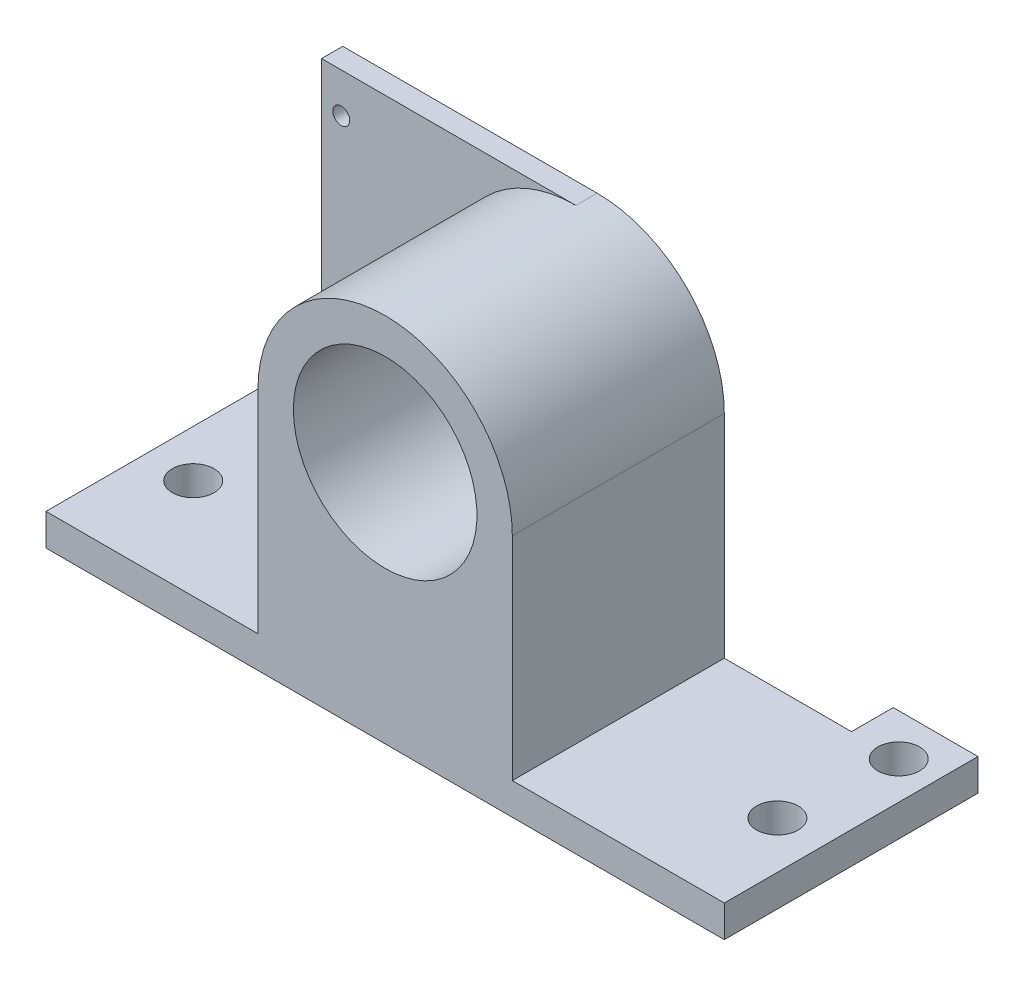
from build123d import *

# Parameters (mm, degrees)
SKETCH1_R               = 11
BOSS_EXTRUDE1_DEPTH     = 30.4
CUT_EXTRUDE1_DEPTH      = 65.4
CUT_EXTRUDE1_DEPTH_BACK = 30.4
SKETCH2_R               = 2.5
SKETCH2_W               = 60.96
SKETCH2_H               = 5
SKETCH3_R               = 1.016
BOSS_EXTRUDE2_DEPTH     = 2.54


with BuildPart() as part:
    # Sketch1 → Boss-Extrude1 (new body)
    with BuildSketch(Plane.XY):
        with BuildLine():
            Line((-40.64, -29.21), (40.64, -29.21))
            Line((40.64, -29.21), (40.64, -25.4))
            Line((40.64, -25.4), (15.24, -25.4))
            Line((15.24, -25.4), (15.24, 0))
            ThreePointArc((15.24, 0), (0, 15.24), (-15.24, 0))
            Line((-15.24, 0), (-15.24, -25.4))
            Line((-15.24, -25.4), (-40.64, -25.4))
            Line((-40.64, -25.4), (-40.64, -29.21))
        make_face()
        with Locations(Location((0, 0, 0), (0, 0, 180))):
            Circle(SKETCH1_R, mode=Mode.SUBTRACT)
    extrude(amount=BOSS_EXTRUDE1_DEPTH)

    # Sketch2 → Cut-Extrude1 (cut, two sides: drawn at the far end of the back side and taken through both)
    with BuildSketch(Plane(origin=(0, -25.4, 0), x_dir=(1, 0, 0), z_dir=(0, 1, 0)).offset(-CUT_EXTRUDE1_DEPTH_BACK)):
        with Locations(Location((-36.14, -5, 0), (0, 0, 90))):
            Circle(SKETCH2_R)
        with Locations(Location((-35, -18.4, 0), (0, 0, 90))):
            Circle(SKETCH2_R)
        with Locations(Location((36.14, -5, 0), (0, 0, 90))):
            Circle(SKETCH2_R)
        with Locations(Location((35, -18.4, 0), (0, 0, 90))):
            Circle(SKETCH2_R)
        with Locations((0, -2.5)):
            Rectangle(SKETCH2_W, SKETCH2_H)
    extrude(amount=CUT_EXTRUDE1_DEPTH + CUT_EXTRUDE1_DEPTH_BACK, mode=Mode.SUBTRACT)

    # Sketch3 → Boss-Extrude2 (add)
    with BuildSketch(Plane(origin=(0, 0, 5), x_dir=(-1, 0, 0), z_dir=(0, 0, -1))):
        with BuildLine():
            Line((0, 11), (0, 15.24))
            Line((0, 15.24), (30.48, 15.24))
            Line((30.48, 15.24), (30.48, -25.4))
            Line((30.48, -25.4), (0, -25.4))
            Line((0, -25.4), (0, -11))
            ThreePointArc((0, -11), (11, 0), (0, 11))
        make_face()
        with Locations((28.1178, 10.4775)):
            Circle(SKETCH3_R, mode=Mode.SUBTRACT)
        with Locations((28.1178, -10.4775)):
            Circle(SKETCH3_R, mode=Mode.SUBTRACT)
    extrude(amount=-BOSS_EXTRUDE2_DEPTH)


solid = part.part
